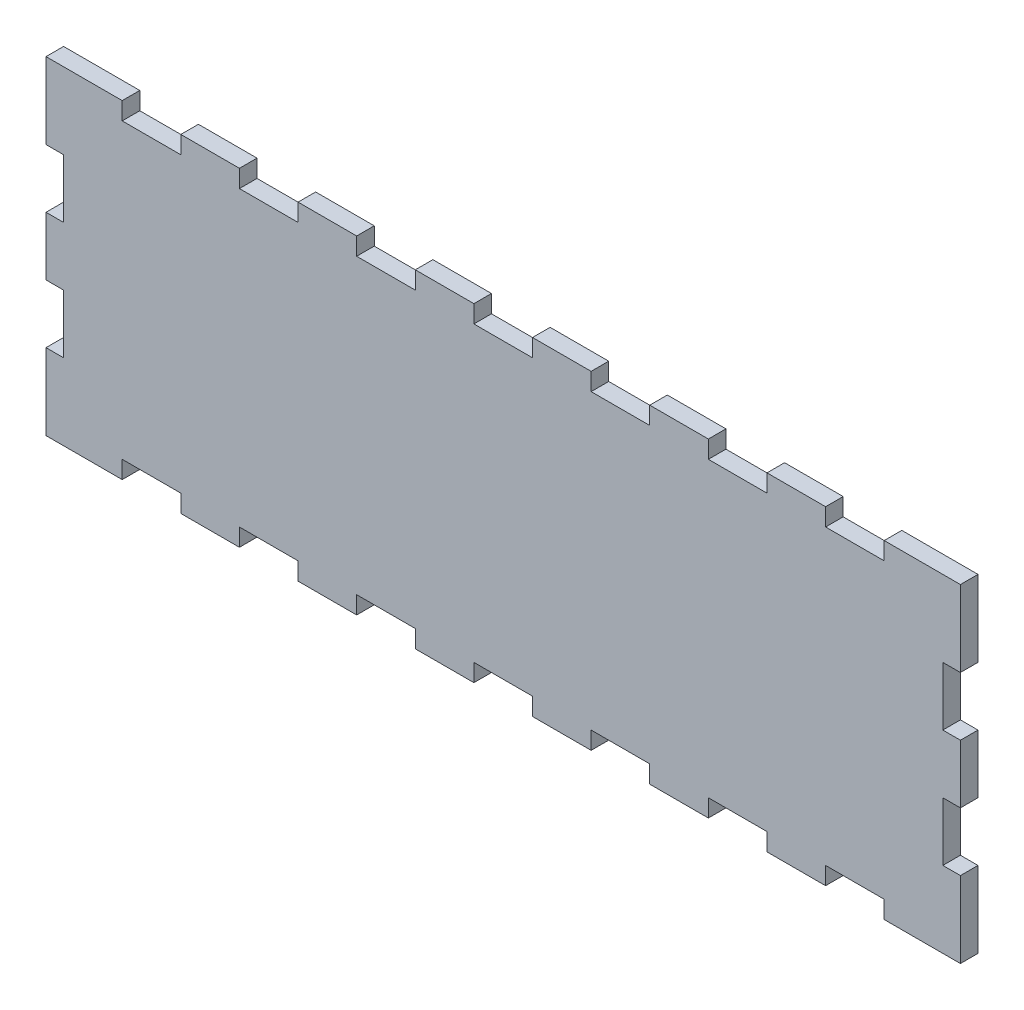
from build123d import *

# Parameters (mm, degrees)
BOSS_EXTRUDE1_DEPTH = 3


with BuildPart() as part:
    # Sketch1 → Boss-Extrude1 (new body)
    with BuildSketch(Plane.XY):
        Polygon((15, 28), (15, 25), (25, 25), (25, 28), (35, 28), (35, 25), (45, 25), (45, 28), (55, 28), (55, 25), (65, 25), (65, 28), (78, 28), (78, 15), (75, 15), (75, 5), (78, 5), (78, -5), (75, -5), (75, -15), (78, -15), (78, -28), (65, -28), (65, -25), (55, -25), (55, -28), (45, -28), (45, -25), (35, -25), (35, -28), (25, -28), (25, -25), (15, -25), (15, -28), (5, -28), (5, -25), (-5, -25), (-5, -28), (-15, -28), (-15, -25), (-25, -25), (-25, -28), (-35, -28), (-35, -25), (-45, -25), (-45, -28), (-55, -28), (-55, -25), (-65, -25), (-65, -28), (-78, -28), (-78, -15), (-75, -15), (-75, -5), (-78, -5), (-78, 5), (-75, 5), (-75, 15), (-78, 15), (-78, 28), (-65, 28), (-65, 25), (-55, 25), (-55, 28), (-45, 28), (-45, 25), (-35, 25), (-35, 28), (-25, 28), (-25, 25), (-15, 25), (-15, 28), (-5, 28), (-5, 25), (5, 25), (5, 28), align=None)
    extrude(amount=BOSS_EXTRUDE1_DEPTH)


solid = part.part
